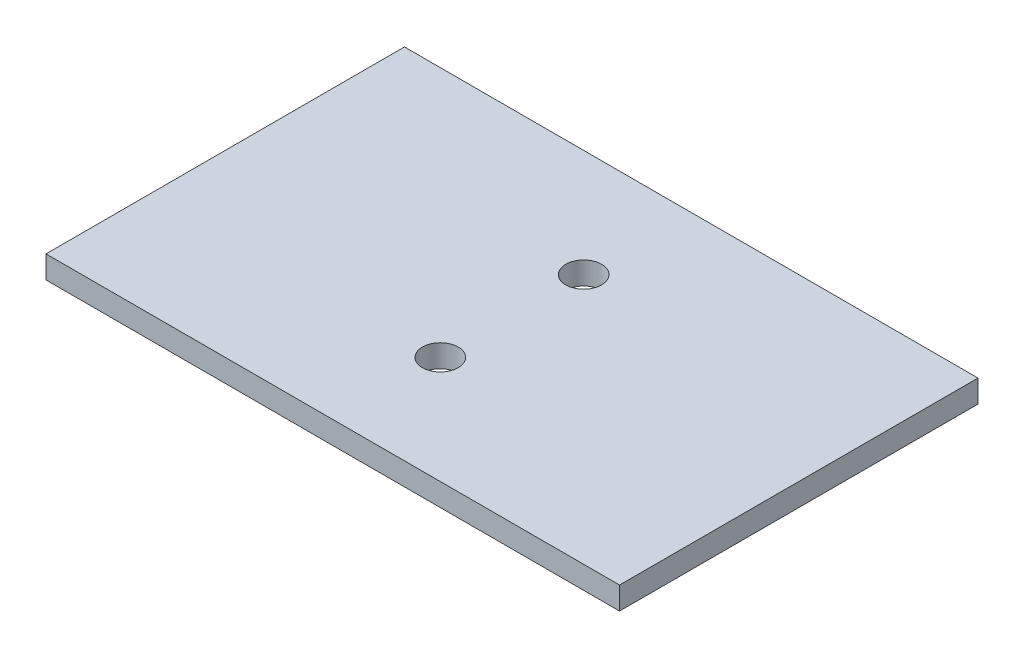
from build123d import *

# Parameters (mm, degrees)
SKETCH1_W           = 50.8
SKETCH1_H           = 31.75
SKETCH1_R           = 1.5875
BOSS_EXTRUDE1_DEPTH = 2


with BuildPart() as part:
    # Sketch1 → Boss-Extrude1 (new body)
    with BuildSketch(Plane(origin=(0, 0, 0), x_dir=(1, 0, 0), z_dir=(0, 1, 0))):
        Rectangle(SKETCH1_W, SKETCH1_H)
        with Locations(Location((0, 6.35, 0), (0, 0, 270))):
            Circle(SKETCH1_R, mode=Mode.SUBTRACT)
        with Locations(Location((0, -6.35, 0), (0, 0, 270))):
            Circle(SKETCH1_R, mode=Mode.SUBTRACT)
    extrude(amount=BOSS_EXTRUDE1_DEPTH)


solid = part.part
